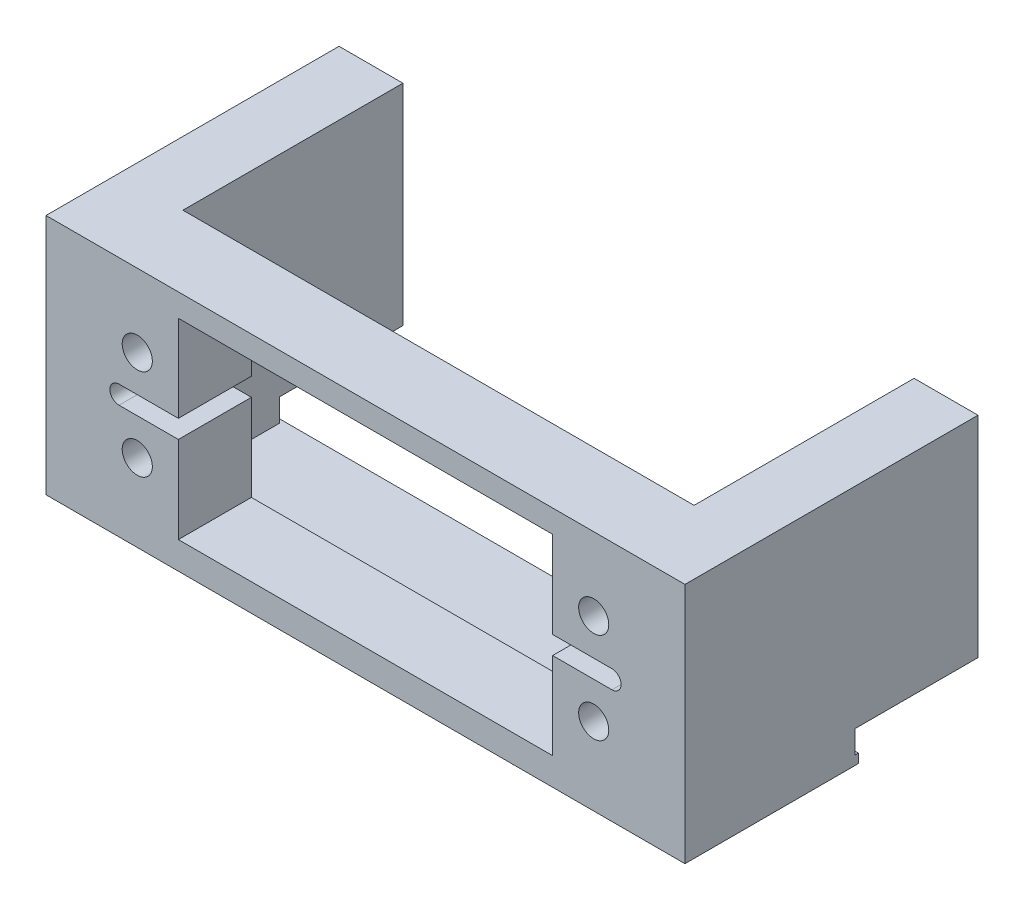
from build123d import *

# Parameters (mm, degrees)
SKETCH_1_W          = 70
SKETCH_1_H          = 25
EXTRUDE_1_DEPTH     = 8
SKETCH_2_W          = 41
SKETCH_2_H          = 21
CUT_EXTRUDE_1_DEPTH = 24
CUT_EXTRUDE_4_DEPTH = 39.016443811
EXTRUDE_START       = -8
SKETCH_5_W          = 7
SKETCH_5_H          = 25
EXTRUDE_2_DEPTH     = 24.1
SKETCH_9_W          = 7
SKETCH_9_H          = 13.5
CUT_EXTRUDE_3_DEPTH = 2
EXTRUDE_11_DEPTH    = 0.5
SKETCH_20_W         = 70
SKETCH_20_H         = 19
EXTRUDE_12_DEPTH    = 1
M4X0_7_3_D          = 3.3


with BuildPart() as part:
    # 草圖1 → 填料-伸長1 (new body)
    with BuildSketch(Plane.XY):
        Rectangle(SKETCH_1_W, SKETCH_1_H)
    extrude(amount=EXTRUDE_1_DEPTH)

    # 草圖2 → 除料-伸長1 (cut)
    with BuildSketch(Plane(origin=(0, 0, 0), x_dir=(-1, 0, 0), z_dir=(0, 0, -1))):
        with Locations((0, -0.5)):
            Rectangle(SKETCH_2_W, SKETCH_2_H)
    extrude(amount=-CUT_EXTRUDE_1_DEPTH, mode=Mode.SUBTRACT)

    # 草圖10 → 除料-伸長4 (cut, through all)
    with BuildSketch(Plane.XY.offset(8)):
        with BuildLine():
            Line((-27, 0.5), (-14, 0.5))
            ThreePointArc((-14, 0.5), (-13, -0.5), (-14, -1.5))
            Line((-14, -1.5), (-27, -1.5))
            ThreePointArc((-27, -1.5), (-28, -0.5), (-27, 0.5))
        make_face()
    cut_extrude_4 = extrude(amount=-CUT_EXTRUDE_4_DEPTH, mode=Mode.SUBTRACT)

    # 草圖5 → 填料-伸長2 (add)
    with BuildSketch(Plane.XY.offset(8).offset(EXTRUDE_START)):
        with Locations((-31.5, 0)):
            Rectangle(SKETCH_5_W, SKETCH_5_H)
    extrude_2 = extrude(amount=-EXTRUDE_2_DEPTH)

    # 草圖8 → M4x0.7 螺紋孔1 (revolve, cut)
    with BuildSketch(Plane(origin=(-31.5, 0, -24.1), x_dir=(0, 1, 0), z_dir=(1, 0, 0))):
        Polygon((0, 0), (0, 30.991420021), (1.65, 30), (1.65, 0), align=None)
    m4x0_7_1 = revolve(axis=Axis((-31.5, 0, -30.45), (0, 0, 1)), mode=Mode.SUBTRACT)

    # 鏡射1: 除料-伸長4, 填料-伸長2, M4x0.7 螺紋孔1 across plane
    add(cut_extrude_4.mirror(Plane(origin=(0, 0, 0), x_dir=(0, 0, 1), z_dir=(1, 0, 0))), mode=Mode.SUBTRACT)
    add(extrude_2.mirror(Plane(origin=(0, 0, 0), x_dir=(0, 0, 1), z_dir=(1, 0, 0))))
    add(m4x0_7_1.mirror(Plane(origin=(0, 0, 0), x_dir=(0, 0, 1), z_dir=(1, 0, 0))), mode=Mode.SUBTRACT)

    # 草圖9 → 除料-伸長3 (cut)
    with BuildSketch(Plane.XZ.offset(12.5)):
        with Locations((31.5, -17.35)):
            Rectangle(SKETCH_9_W, SKETCH_9_H)
        with Locations((-31.5, -17.35)):
            Rectangle(SKETCH_9_W, SKETCH_9_H)
    extrude(amount=-CUT_EXTRUDE_3_DEPTH, mode=Mode.SUBTRACT)

    # 草圖19 → 填料-伸長11 (add)
    with BuildSketch(Plane.XZ.offset(12.5)):
        Polygon((35, 8), (-35, 8), (-35, -10.6), (-28, -10.6), (-28, 0), (28, 0), (28, -10.6), (35, -10.6), align=None)
    extrude(amount=EXTRUDE_11_DEPTH)

    # 草圖20 → 填料-伸長12 (add)
    with BuildSketch(Plane.XZ.offset(13)):
        with Locations((0, -1.5)):
            Rectangle(SKETCH_20_W, SKETCH_20_H)
    extrude(amount=EXTRUDE_12_DEPTH)

    # M4x0.7 螺紋孔3 (through all)
    with Locations(Plane.XY.offset(8)):
        with Locations((25, -5.5), (-25, 4.5), (-25, -5.5), (25, 4.5)):
            Hole(M4X0_7_3_D / 2)


solid = part.part
